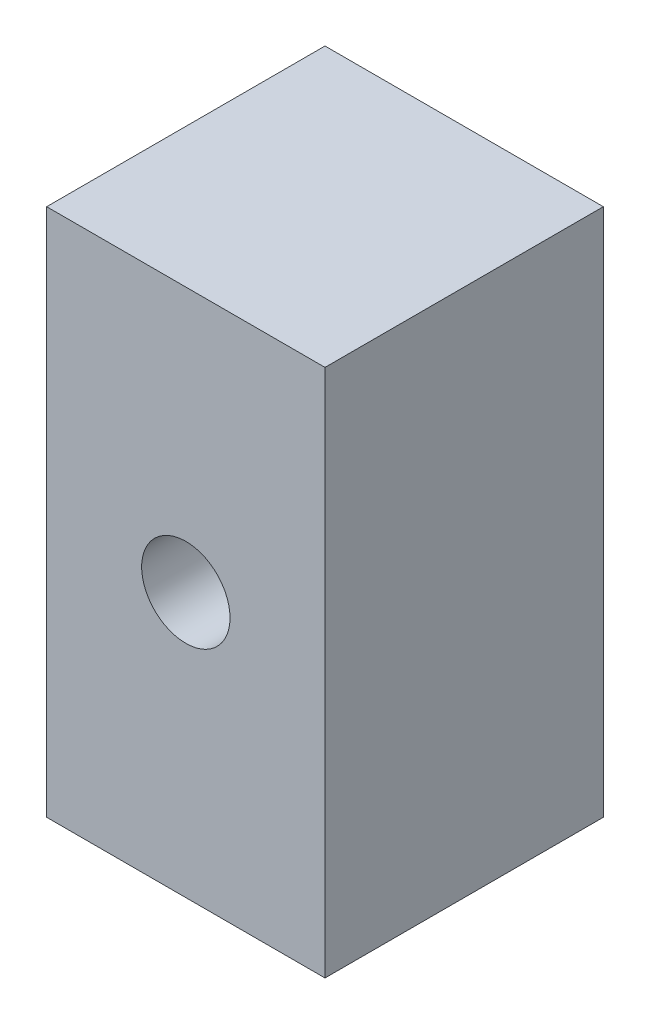
from build123d import *

# Parameters (mm, degrees)
SKETCH1_W           = 20
SKETCH1_H           = 20
BOSS_EXTRUDE1_DEPTH = 38
SKETCH2_R           = 3.175
CUT_EXTRUDE1_DEPTH  = 38


with BuildPart() as part:
    # Sketch1 → Boss-Extrude1 (new body)
    with BuildSketch(Plane(origin=(0, 0, 0), x_dir=(1, 0, 0), z_dir=(0, 1, 0))):
        with Locations((10, 10)):
            Rectangle(SKETCH1_W, SKETCH1_H)
    extrude(amount=BOSS_EXTRUDE1_DEPTH)

    # Sketch2 → Cut-Extrude1 (cut)
    with BuildSketch(Plane.XY):
        with Locations((10, 19)):
            Circle(SKETCH2_R)
    extrude(amount=-CUT_EXTRUDE1_DEPTH, mode=Mode.SUBTRACT)


solid = part.part
